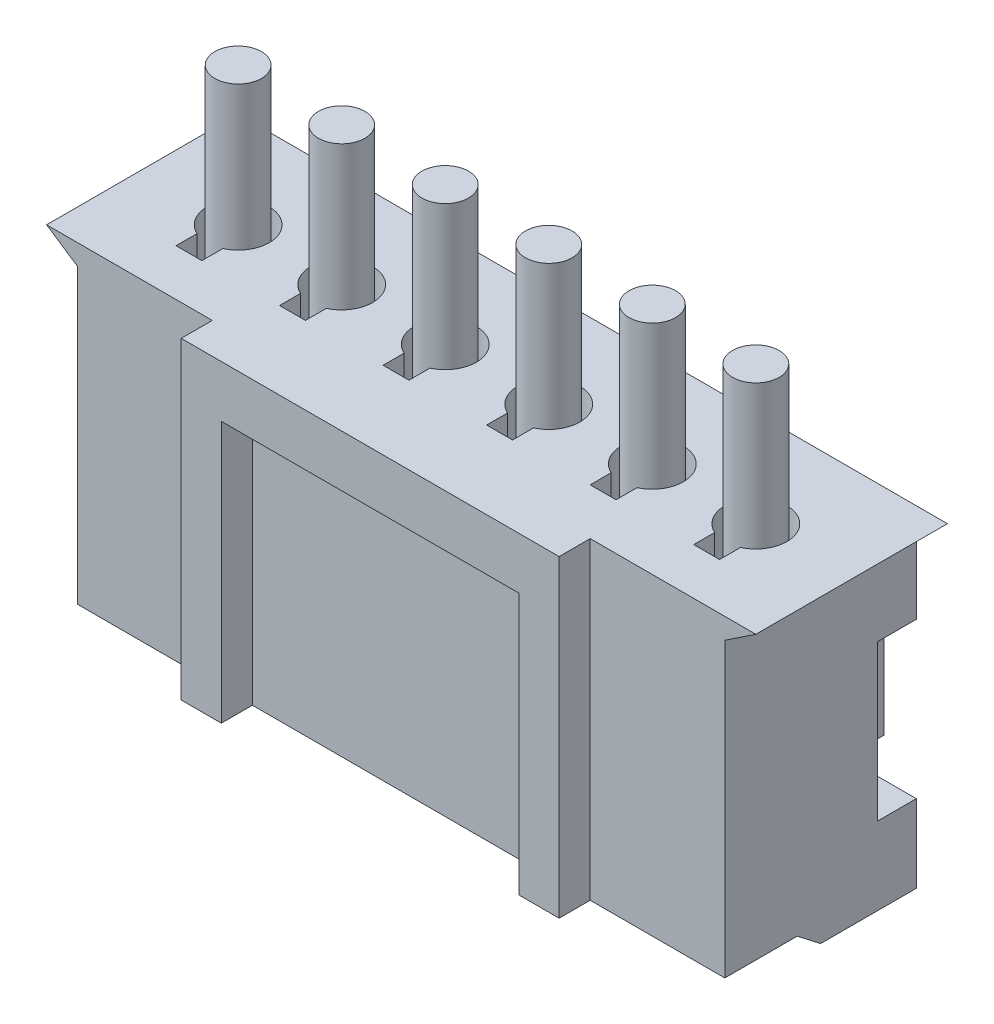
from build123d import *

# Parameters (mm, degrees)
SKETCH_1_W             = 13.7
SKETCH_1_H             = 3.7
EXTRUDE_1_DEPTH        = 6.4
CUT_EXTRUDE_1_REACH    = 12.078
EXTRUDE_2_DEPTH        = 0.6
CUT_EXTRUDE_2_REACH    = 16.784
SKETCH_6_W             = 0.5
SKETCH_6_H             = 0.5
CUT_EXTRUDE_3_DEPTH    = 6.05
PATTERN_LINEAR_1_COUNT = 6
PATTERN_LINEAR_1_PITCH = 2
SKETCH_7_W             = 0.5
SKETCH_7_H             = 0.5
CUT_EXTRUDE_4_DEPTH    = 4.5
PATTERN_LINEAR_2_COUNT = 5
PATTERN_LINEAR_2_PITCH = 2
SKETCH_8_W             = 12.5
SKETCH_8_H             = 0.75
CUT_EXTRUDE_5_DEPTH    = 0.75
SKETCH_9_W             = 0.75
SKETCH_9_H             = 3
CUT_EXTRUDE_6_DEPTH    = 0.75
PATTERN_LINEAR_3_COUNT = 7
PATTERN_LINEAR_3_PITCH = 2
SKETCH_10_W            = 0.75
SKETCH_10_H            = 1.264727748
CUT_EXTRUDE_7_DEPTH    = 2.5
PATTERN_LINEAR_4_COUNT = 6
PATTERN_LINEAR_4_PITCH = 2
SKETCH_11_R            = 0.6
CUT_EXTRUDE_8_DEPTH    = 2.5
PATTERN_LINEAR_5_COUNT = 6
PATTERN_LINEAR_5_PITCH = 2
SKETCH_12_R            = 0.45
EXTRUDE_4_DEPTH        = 3
PATTERN_LINEAR_6_COUNT = 6
PATTERN_LINEAR_6_PITCH = 2
SKETCH_15_R            = 0.45
PATTERN_LINEAR_7_COUNT = 6
PATTERN_LINEAR_7_PITCH = 2
SKETCH_16_W            = 19.020248072
SKETCH_16_H            = 7.063508143
CUT_EXTRUDE_9_DEPTH    = 4


with BuildPart() as part:
    # 草图1 → 凸台-拉伸1 (new body)
    with BuildSketch(Plane(origin=(0, 0, 0), x_dir=(1, 0, 0), z_dir=(0, 1, 0))):
        Rectangle(SKETCH_1_W, SKETCH_1_H)
    extrude(amount=EXTRUDE_1_DEPTH)

    # 草图2 → 切除-拉伸1 (cut, up to next)
    with BuildSketch(Plane.XY.offset(1.85), mode=Mode.PRIVATE) as cut_extrude_1_sk1:
        Polygon((-6.25, 0), (-6.25, 6), (-6.85, 6.4), (-6.85, 0), align=None)
    cut_extrude_1_tool1 = extrude(cut_extrude_1_sk1.sketch, amount=-CUT_EXTRUDE_1_REACH, mode=Mode.PRIVATE) & part.part
    # 草图2 → 切除-拉伸1 (cut, up to next)
    with BuildSketch(Plane.XY.offset(1.85), mode=Mode.PRIVATE) as cut_extrude_1_sk2:
        Polygon((6.85, 0), (6.25, 0), (6.25, 6), (6.85, 6.4), align=None)
    cut_extrude_1_tool2 = extrude(cut_extrude_1_sk2.sketch, amount=-CUT_EXTRUDE_1_REACH, mode=Mode.PRIVATE) & part.part
    add(cut_extrude_1_tool1.solids().sort_by_distance((-6.553226, 3.101075, 1.85))[0], mode=Mode.SUBTRACT)
    add(cut_extrude_1_tool2.solids().sort_by_distance((6.553226, 3.101075, 1.85))[0], mode=Mode.SUBTRACT)

    # 草图4 → 凸台-拉伸2 (add)
    with BuildSketch(Plane.XY.offset(1.85)):
        Polygon((-3.65, 0), (-2.875, 0), (-2.875, 5.4), (2.875, 5.4), (2.875, 0), (3.65, 0), (3.65, 6.4), (-3.65, 6.4), align=None)
    extrude(amount=EXTRUDE_2_DEPTH)

    # 切除-拉伸2: up to this face of the body (flat: up to its plane)
    cut_extrude_2_end = Plane(part.part.faces().sort_by_distance((6.25, 3, 0))[0])
    # 草图5 → 切除-拉伸2 (cut, up to the picked face)
    with BuildSketch(Plane.ZY.offset(6.25), mode=Mode.PRIVATE) as cut_extrude_2_sk1:
        Polygon((2.45, 0.35), (0.45, 0.35), (0, 0), (2.45, 0), align=None)
    cut_extrude_2_tool1 = split(extrude(cut_extrude_2_sk1.sketch, amount=-CUT_EXTRUDE_2_REACH, mode=Mode.PRIVATE), bisect_by=cut_extrude_2_end, keep=Keep.BOTH, mode=Mode.PRIVATE)
    add(cut_extrude_2_tool1.solids().sort_by(Axis((-6.25, 0.169101, 1.333708), (1, 0, 0)))[0], mode=Mode.SUBTRACT)

    # 草图6 → 切除-拉伸3 (cut)
    with BuildSketch(Plane.XZ.offset(-0.35)):
        with Locations((-5, 0.7)):
            Rectangle(SKETCH_6_W, SKETCH_6_H)
    cut_extrude_3 = extrude(amount=-CUT_EXTRUDE_3_DEPTH, mode=Mode.SUBTRACT)

    # 阵列(线性)1: 切除-拉伸3 ×6
    with Locations(*[(i * PATTERN_LINEAR_1_PITCH, 0, 0) for i in range(1, PATTERN_LINEAR_1_COUNT)]):
        add(cut_extrude_3, mode=Mode.SUBTRACT)

    # 草图7 → 切除-拉伸4 (cut)
    with BuildSketch(Plane.XZ):
        with Locations((-4, -1.6)):
            Rectangle(SKETCH_7_W, SKETCH_7_H)
    cut_extrude_4 = extrude(amount=-CUT_EXTRUDE_4_DEPTH, mode=Mode.SUBTRACT)

    # 阵列(线性)2: 切除-拉伸4 ×5
    with Locations(*[(i * PATTERN_LINEAR_2_PITCH, 0, 0) for i in range(1, PATTERN_LINEAR_2_COUNT)]):
        add(cut_extrude_4, mode=Mode.SUBTRACT)

    # 草图8 → 切除-拉伸5 (cut)
    with BuildSketch(Plane(origin=(0, 0, -1.85), x_dir=(-1, 0, 0), z_dir=(0, 0, -1))):
        with Locations((0, 1.875)):
            Rectangle(SKETCH_8_W, SKETCH_8_H)
    extrude(amount=-CUT_EXTRUDE_5_DEPTH, mode=Mode.SUBTRACT)

    # 草图9 → 切除-拉伸6 (cut)
    with BuildSketch(Plane(origin=(0, 0, -1.85), x_dir=(-1, 0, 0), z_dir=(0, 0, -1))):
        with Locations((-6, 3)):
            Rectangle(SKETCH_9_W, SKETCH_9_H)
    cut_extrude_6 = extrude(amount=-CUT_EXTRUDE_6_DEPTH, mode=Mode.SUBTRACT)

    # 阵列(线性)3: 切除-拉伸6 ×7
    with Locations(*[(-i * PATTERN_LINEAR_3_PITCH, 0, 0) for i in range(1, PATTERN_LINEAR_3_COUNT)]):
        add(cut_extrude_6, mode=Mode.SUBTRACT)

    # 草图10 → 切除-拉伸7 (cut)
    with BuildSketch(Plane(origin=(0, 0, -1.85), x_dir=(-1, 0, 0), z_dir=(0, 0, -1))):
        with Locations((-5, 1.232363874)):
            Rectangle(SKETCH_10_W, SKETCH_10_H)
    cut_extrude_7 = extrude(amount=-CUT_EXTRUDE_7_DEPTH, mode=Mode.SUBTRACT)

    # 阵列(线性)4: 切除-拉伸7 ×6
    with Locations(*[(-i * PATTERN_LINEAR_4_PITCH, 0, 0) for i in range(1, PATTERN_LINEAR_4_COUNT)]):
        add(cut_extrude_7, mode=Mode.SUBTRACT)

    # 草图11 → 切除-拉伸8 (cut)
    with BuildSketch(Plane(origin=(0, 6.4, 0), x_dir=(1, 0, 0), z_dir=(0, 1, 0))):
        with Locations((-5, 0)):
            Circle(SKETCH_11_R)
    cut_extrude_8 = extrude(amount=-CUT_EXTRUDE_8_DEPTH, mode=Mode.SUBTRACT)

    # 阵列(线性)5: 切除-拉伸8 ×6
    with Locations(*[(i * PATTERN_LINEAR_5_PITCH, 0, 0) for i in range(1, PATTERN_LINEAR_5_COUNT)]):
        add(cut_extrude_8, mode=Mode.SUBTRACT)

    # 草图12 → 凸台-拉伸4 (add)
    with BuildSketch(Plane(origin=(0, 3.9, 0), x_dir=(1, 0, 0), z_dir=(0, 1, 0))):
        with Locations(Location((-5, 0, 0), (0, 0, 270))):
            Circle(SKETCH_12_R)
    extrude_4 = extrude(amount=EXTRUDE_4_DEPTH)

    # 阵列(线性)6: 凸台-拉伸4 ×6
    with Locations(*[(i * PATTERN_LINEAR_6_PITCH, 0, 0) for i in range(1, PATTERN_LINEAR_6_COUNT)]):
        add(extrude_4)

    # 扫描1: sweep along a path in 草图13
    with BuildLine(Plane.ZY.offset(5)) as sweep_1_path:
        Line((0, 6.9), (0, 13.072800135))
    # 草图15 → 扫描1 (sweep)
    with BuildSketch(Plane(origin=(0, 6.9, 0), x_dir=(1, 0, 0), z_dir=(0, 1, 0))):
        with Locations((-5, 0)):
            Circle(SKETCH_15_R)
    sweep_1 = sweep(path=sweep_1_path.line)

    # 阵列(线性)7: 扫描1 ×6
    with Locations(*[(i * PATTERN_LINEAR_7_PITCH, 0, 0) for i in range(1, PATTERN_LINEAR_7_COUNT)]):
        add(sweep_1)

    # 草图16 → 切除-拉伸9 (cut)
    with BuildSketch(Plane(origin=(0, 13.072800135, 0), x_dir=(1, 0, 0), z_dir=(0, 1, 0))):
        with Locations((-1.031218269, 0.439526414)):
            Rectangle(SKETCH_16_W, SKETCH_16_H)
    extrude(amount=-CUT_EXTRUDE_9_DEPTH, mode=Mode.SUBTRACT)


solid = part.part
